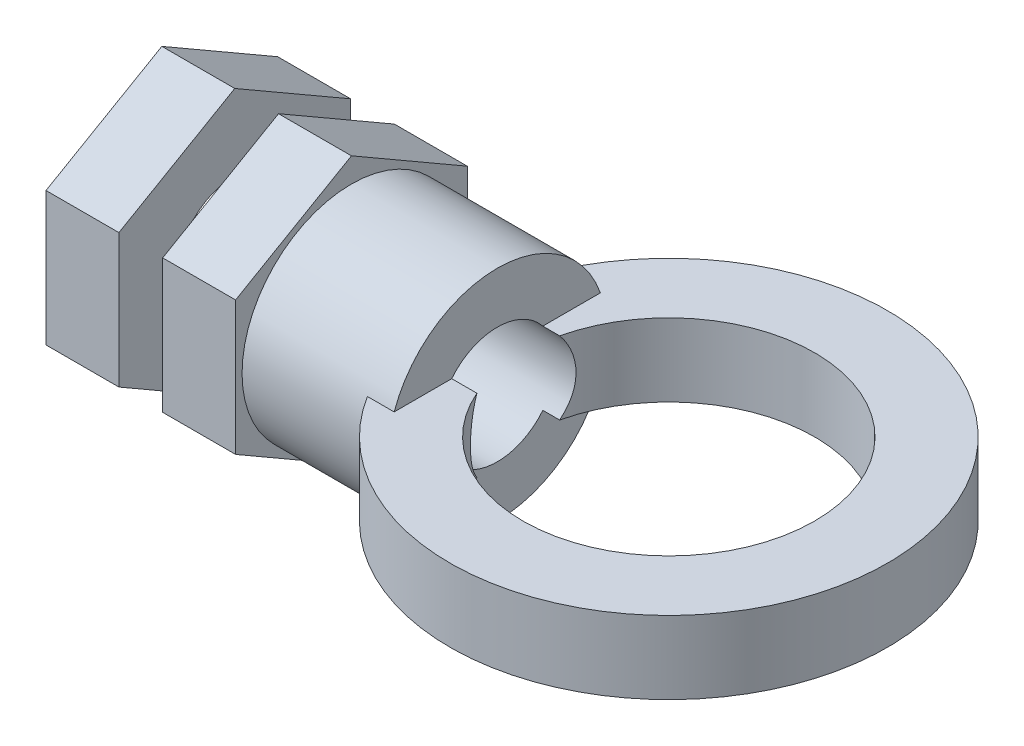
from build123d import *

# Parameters (mm, degrees)
SKETCH1_R           = 7.5
SKETCH1_R_2         = 4
BOSS_EXTRUDE1_DEPTH = 10
SKETCH2_R           = 15
SKETCH2_R_2         = 10
BOSS_EXTRUDE2_DEPTH = 2.5
BOSS_EXTRUDE3_DEPTH = 5
BOSS_EXTRUDE4_START = -8
BOSS_EXTRUDE4_DEPTH = 5
CUT_EXTRUDE1_START  = -13
SKETCH1_3_R         = 4
CUT_EXTRUDE1_DEPTH  = 25.159292


with BuildPart() as part:
    # Sketch1 → Boss-Extrude1 (new body)
    with BuildSketch(Plane(origin=(0, 0, 0), x_dir=(0, 0, -1), z_dir=(1, 0, 0))):
        Circle(SKETCH1_R)
        Circle(SKETCH1_R_2, mode=Mode.SUBTRACT)
    extrude(amount=BOSS_EXTRUDE1_DEPTH)

    # Sketch2 → Boss-Extrude2 (add, symmetric)
    with BuildSketch(Plane(origin=(0, 0, 0), x_dir=(1, 0, 0), z_dir=(0, 1, 0))):
        with Locations((20.896682981, 0.863950162)):
            Circle(SKETCH2_R)
        with Locations(Location((20.896682981, 0.863950162, 0), (0, 0, 270))):
            Circle(SKETCH2_R_2, mode=Mode.SUBTRACT)
    extrude(amount=BOSS_EXTRUDE2_DEPTH, both=True)

    # Sketch3 → Boss-Extrude3 (add)
    with BuildSketch(Plane(origin=(0, 0, 0), x_dir=(0, 0, -1), z_dir=(1, 0, 0))):
        Polygon((0, -9.173417626), (7.944412704, -4.586708813), (7.944412704, 4.586708813), (0, 9.173417626), (-7.944412704, 4.586708813), (-7.944412704, -4.586708813), align=None)
    extrude(amount=-BOSS_EXTRUDE3_DEPTH)


with BuildPart() as body_2:
    # Sketch3<2> → Boss-Extrude4 (new body)
    with BuildSketch(Plane(origin=(0, 0, 0), x_dir=(0, 0, -1), z_dir=(1, 0, 0)).offset(BOSS_EXTRUDE4_START)):
        Polygon((0, -9.173417626), (7.944412704, -4.586708813), (7.944412704, 4.586708813), (0, 9.173417626), (-7.944412704, 4.586708813), (-7.944412704, -4.586708813), align=None)
    extrude(amount=-BOSS_EXTRUDE4_DEPTH)


with BuildPart() as cut_extrude1_tool:
    # Sketch1<3> → Cut-Extrude1 (new body)
    with BuildSketch(Plane(origin=(0, 0, 0), x_dir=(0, 0, -1), z_dir=(1, 0, 0)).offset(CUT_EXTRUDE1_START)):
        Circle(SKETCH1_3_R)
    extrude(amount=CUT_EXTRUDE1_DEPTH)


with BuildPart() as part_1:
    add(part.part)

    # Cut-Extrude1: cut by cut_extrude1_tool
    add(cut_extrude1_tool.part, mode=Mode.SUBTRACT)


with BuildPart() as body_2_1:
    add(body_2.part)

    # Cut-Extrude1: cut by cut_extrude1_tool
    add(cut_extrude1_tool.part, mode=Mode.SUBTRACT)


solid = Compound([part_1.part, body_2_1.part])
